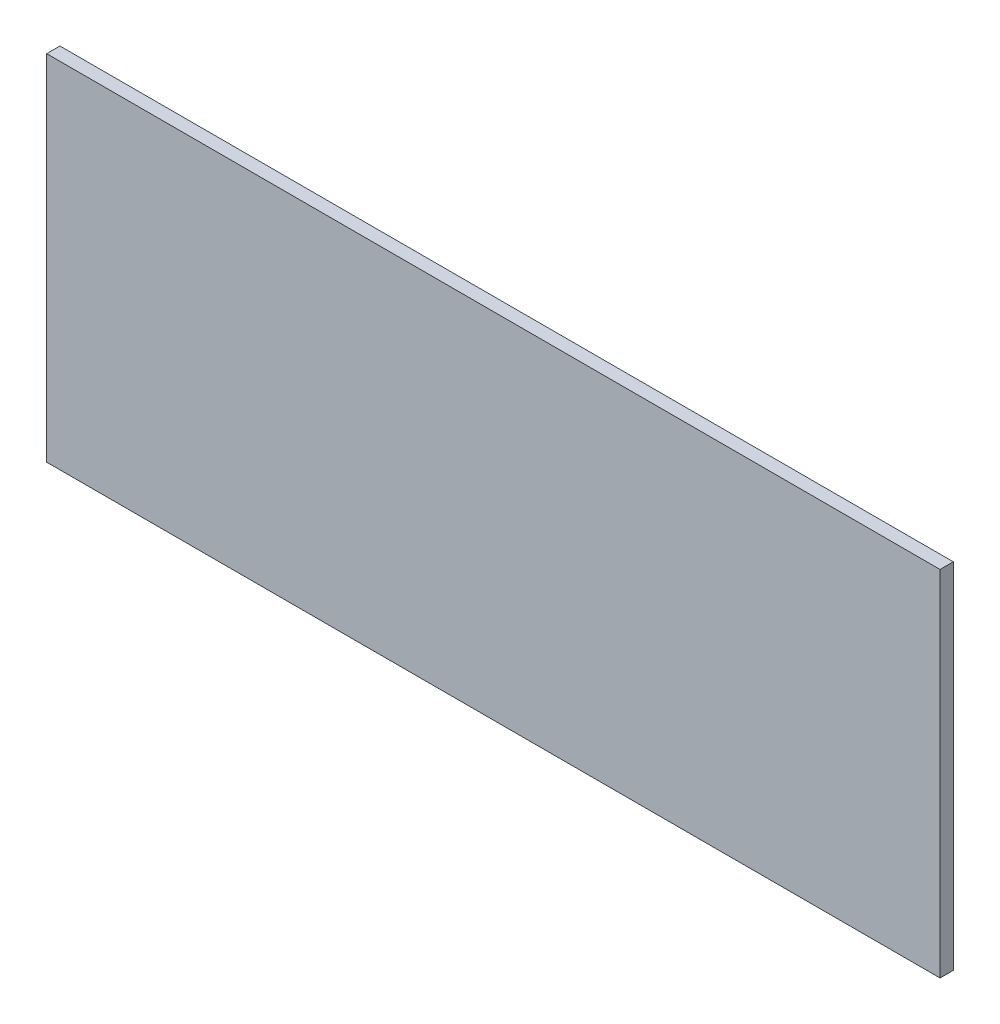
from build123d import *

# Parameters (mm, degrees)
SKETCH_1_W      = 101
SKETCH_1_H      = 40
EXTRUDE_1_DEPTH = 1.5


with BuildPart() as part:
    # Эскиз1 → Бобышка-Вытянуть1 (new body)
    with BuildSketch(Plane.XY):
        Rectangle(SKETCH_1_W, SKETCH_1_H)
    extrude(amount=EXTRUDE_1_DEPTH)


solid = part.part
